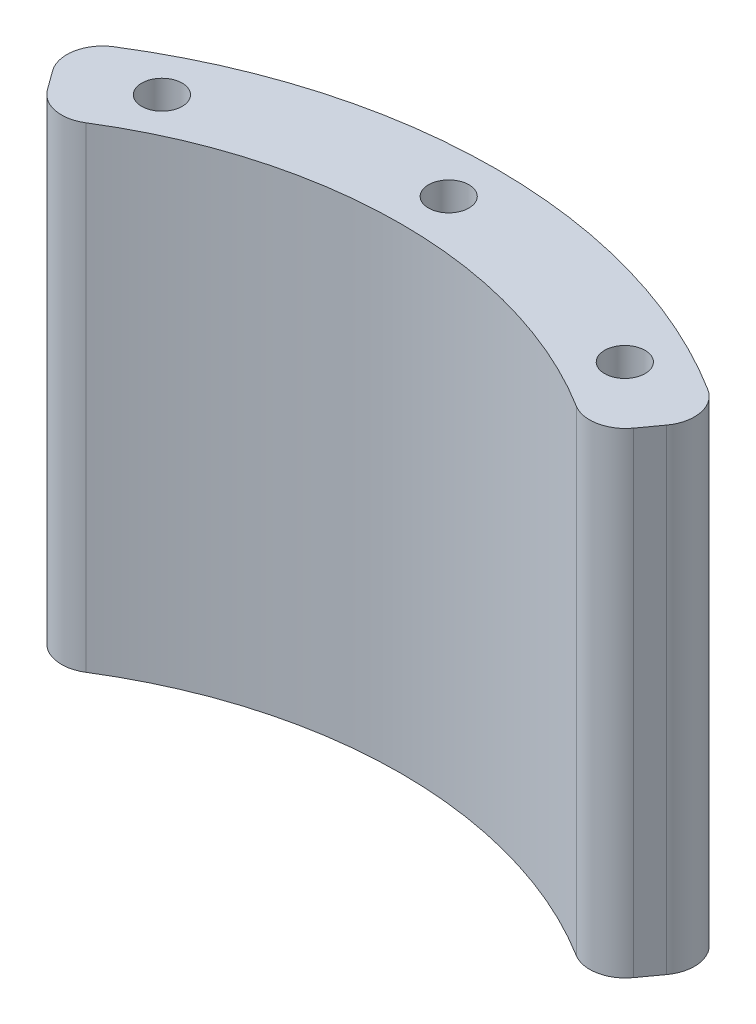
from build123d import *

# Parameters (mm, degrees)
SKETCH_1_R      = 1.7
EXTRUDE_1_DEPTH = 40
FILLET_1_R      = 3


with BuildPart() as part:
    # 草图1 → 凸台-拉伸1 (new body)
    with BuildSketch(Plane(origin=(0, 0, 0), x_dir=(1, 0, 0), z_dir=(0, 1, 0))):
        with BuildLine():
            Line((-22.923624839, 31.551662781), (-27.625906858, 38.023798736))
            ThreePointArc((-27.625906858, 38.023798736), (0, 47), (27.625906858, 38.023798736))
            Line((27.625906858, 38.023798736), (22.923624839, 31.551662781))
            ThreePointArc((22.923624839, 31.551662781), (0, 39), (-22.923624839, 31.551662781))
        make_face()
        with Locations(Location((0, 43, 0), (0, 0, 270))):
            Circle(SKETCH_1_R, mode=Mode.SUBTRACT)
        with Locations(Location((19.451649922, 38.348837209, 0), (0, 0, 270))):
            Circle(SKETCH_1_R, mode=Mode.SUBTRACT)
        with Locations(Location((-19.451649922, 38.348837209, 0), (0, 0, 270))):
            Circle(SKETCH_1_R, mode=Mode.SUBTRACT)
    extrude(amount=EXTRUDE_1_DEPTH)

    # 圆角1
    fillet_1_edges = [part.edges().sort_by_distance(p)[0] for p in [
        (-22.923624839, 20, -31.551662781),
        (-27.625906858, 20, -38.023798736),
        (27.625906858, 20, -38.023798736),
        (22.923624839, 20, -31.551662781),
    ]]
    fillet(fillet_1_edges, radius=FILLET_1_R)


solid = part.part
